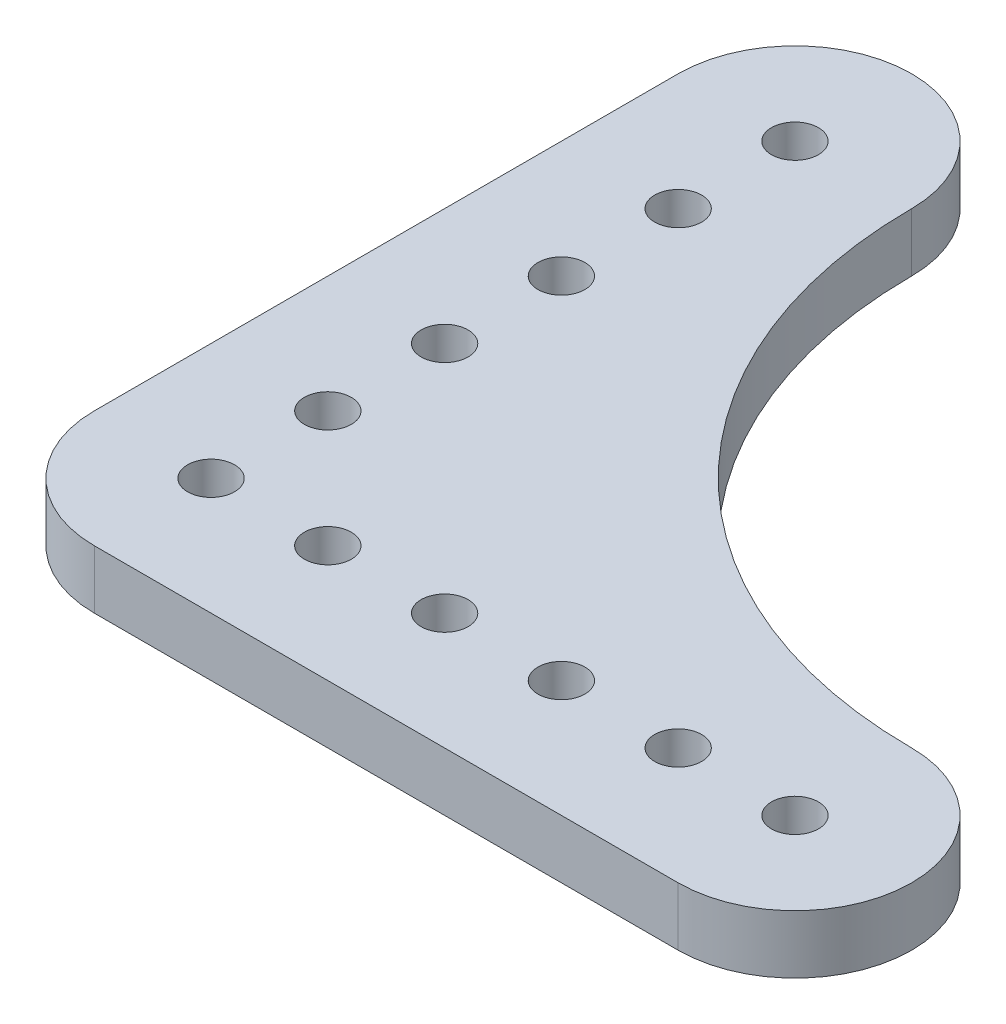
from build123d import *
from build123d.topology import SkipClean

# Parameters (mm, degrees)
SKETCH1_R           = 2.5527
BOSS_EXTRUDE1_DEPTH = 3.175


with BuildPart() as part:
    # Sketch1 → Boss-Extrude1 (new, symmetric)
    # profile 1 of 4: a face of its own
    with SkipClean():  # the faces are left unmerged after this step: merging them gives an invalid solid
        with BuildSketch(Plane(origin=(0, 0, 0), x_dir=(1, 0, 0), z_dir=(0, 1, 0))):
            with BuildLine():
                Line((-12.7, 63.5), (-12.7, 0))
                ThreePointArc((-12.7, 0), (-9.837305348, 8.032273868), (-2.539775829, 12.44345365))
                ThreePointArc((-2.539775829, 12.44345365), (-0.128435844, 15.24946691), (2.5527, 12.7))
                Line((2.5527, 12.7), (12.7, 12.7))
                Line((12.7, 12.7), (12.7, 63.5))
                ThreePointArc((12.7, 63.5), (0, 76.2), (-12.7, 63.5))
            make_face()
            with Locations(Location((0, 25.4, 0), (0, 0, 270))):
                Circle(SKETCH1_R, mode=Mode.SUBTRACT)
            with Locations(Location((0, 38.1, 0), (0, 0, 270))):
                Circle(SKETCH1_R, mode=Mode.SUBTRACT)
            with Locations(Location((0, 50.8, 0), (0, 0, 270))):
                Circle(SKETCH1_R, mode=Mode.SUBTRACT)
            with Locations(Location((0, 63.5, 0), (0, 0, 270))):
                Circle(SKETCH1_R, mode=Mode.SUBTRACT)
        # profile 2 of 4: a face of its own
        with BuildSketch(Plane(origin=(0, 0, 0), x_dir=(1, 0, 0), z_dir=(0, 1, 0))):
            with BuildLine():
                Line((12.7, 12.7), (63.5, 12.7))
                ThreePointArc((63.5, 12.7), (27.578975516, 27.578975516), (12.7, 63.5))
                Line((12.7, 63.5), (12.7, 12.7))
            make_face()
        # profile 3 of 4: a face of its own
        with BuildSketch(Plane(origin=(0, 0, 0), x_dir=(1, 0, 0), z_dir=(0, 1, 0))):
            with BuildLine():
                Line((0, -12.7), (63.5, -12.7))
                ThreePointArc((63.5, -12.7), (76.2, 0), (63.5, 12.7))
                Line((63.5, 12.7), (12.7, 12.7))
                Line((12.7, 12.7), (12.7, 2.5527))
                ThreePointArc((12.7, 2.5527), (14.50503148, 1.80503148), (15.2527, 0))
                ThreePointArc((15.2527, 0), (14.411927484, -1.893563196), (12.44345365, -2.539775829))
                ThreePointArc((12.44345365, -2.539775829), (8.032273868, -9.837305348), (0, -12.7))
            make_face()
            with Locations(Location((25.4, 0, 0), (0, 0, 270))):
                Circle(SKETCH1_R, mode=Mode.SUBTRACT)
            with Locations(Location((38.1, 0, 0), (0, 0, 270))):
                Circle(SKETCH1_R, mode=Mode.SUBTRACT)
            with Locations(Location((50.8, 0, 0), (0, 0, 270))):
                Circle(SKETCH1_R, mode=Mode.SUBTRACT)
            with Locations(Location((63.5, 0, 0), (0, 0, 270))):
                Circle(SKETCH1_R, mode=Mode.SUBTRACT)
        # profile 4 of 4: a face of its own
        with BuildSketch(Plane(origin=(0, 0, 0), x_dir=(1, 0, 0), z_dir=(0, 1, 0))):
            with BuildLine():
                ThreePointArc((-12.7, 0), (-8.980256121, -8.980256121), (0, -12.7))
                ThreePointArc((0, -12.7), (8.032273868, -9.837305348), (12.44345365, -2.539775829))
                ThreePointArc((12.44345365, -2.539775829), (10.15053309, 0.128435844), (12.7, 2.5527))
                Line((12.7, 2.5527), (12.7, 12.7))
                Line((12.7, 12.7), (2.5527, 12.7))
                ThreePointArc((2.5527, 12.7), (0.128435844, 10.15053309), (-2.539775829, 12.44345365))
                ThreePointArc((-2.539775829, 12.44345365), (-9.837305348, 8.032273868), (-12.7, 0))
            make_face()
            with Locations(Location((0, 0, 0), (0, 0, 270))):
                Circle(SKETCH1_R, mode=Mode.SUBTRACT)
        extrude(amount=BOSS_EXTRUDE1_DEPTH, both=True)


solid = part.part
